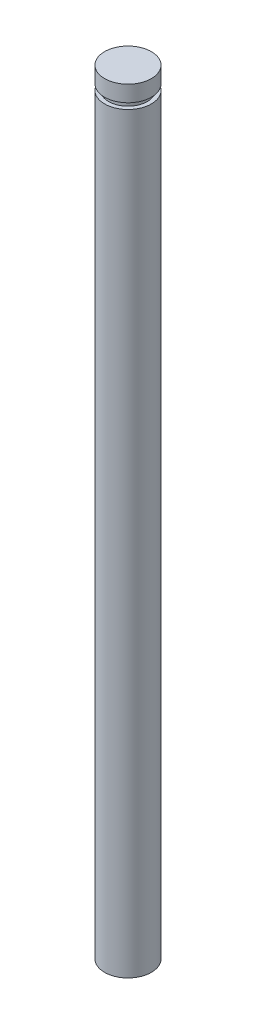
from build123d import *

# Parameters (mm, degrees)
SKETCH1_R           = 0.725
BOSS_EXTRUDE1_DEPTH = 23.32
SKETCH2_R           = 0.6
BOSS_EXTRUDE2_DEPTH = 0.18
SKETCH3_R           = 0.725
BOSS_EXTRUDE3_DEPTH = 0.5


with BuildPart() as part:
    # Sketch1 → Boss-Extrude1 (new body)
    with BuildSketch(Plane(origin=(0, 0, 0), x_dir=(1, 0, 0), z_dir=(0, 1, 0))):
        with Locations(Location((0, 0, 0), (0, 0, 270))):
            Circle(SKETCH1_R)
    extrude(amount=BOSS_EXTRUDE1_DEPTH)

    # Sketch2 → Boss-Extrude2 (add)
    with BuildSketch(Plane(origin=(0, 23.32, 0), x_dir=(1, 0, 0), z_dir=(0, 1, 0))):
        with Locations(Location((0, 0, 0), (0, 0, 270))):
            Circle(SKETCH2_R)
    extrude(amount=BOSS_EXTRUDE2_DEPTH)

    # Sketch3 → Boss-Extrude3 (add)
    with BuildSketch(Plane(origin=(0, 23.5, 0), x_dir=(1, 0, 0), z_dir=(0, 1, 0))):
        with Locations(Location((0, 0, 0), (0, 0, 270))):
            Circle(SKETCH3_R)
    extrude(amount=BOSS_EXTRUDE3_DEPTH)


solid = part.part
